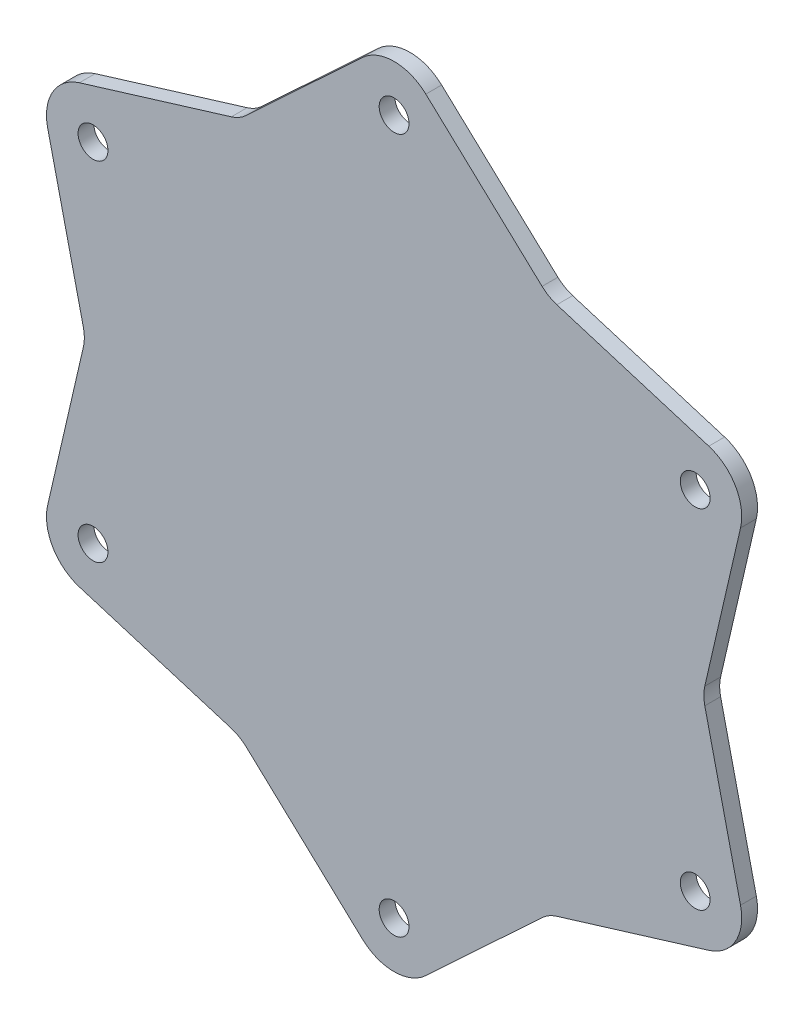
from build123d import *

# Parameters (mm, degrees)
SKETCH1_R           = 3
BOSS_EXTRUDE2_DEPTH = 3.175


with BuildPart() as part:
    # Sketch1 → Boss-Extrude2 (new body)
    with BuildSketch(Plane.XY):
        with BuildLine():
            Line((6.375679422, 76.689094378), (29.728991744, 54.9181954))
            ThreePointArc((29.728991744, 54.9181954), (31.115, 53.892760878), (32.696056474, 53.205159779))
            Line((32.696056474, 53.205159779), (63.226864214, 43.866047535))
            ThreePointArc((63.226864214, 43.866047535), (68.58921198, 39.6), (69.602543635, 32.823046843))
            Line((69.602543635, 32.823046843), (62.425048218, 1.713035621))
            ThreePointArc((62.425048218, 1.713035621), (62.23, 0), (62.425048218, -1.713035621))
            Line((62.425048218, -1.713035621), (69.602543635, -32.823046843))
            ThreePointArc((69.602543635, -32.823046843), (68.58921198, -39.6), (63.226864214, -43.866047535))
            Line((63.226864214, -43.866047535), (32.696056474, -53.205159779))
            ThreePointArc((32.696056474, -53.205159779), (31.115, -53.892760878), (29.728991744, -54.9181954))
            Line((29.728991744, -54.9181954), (6.375679422, -76.689094378))
            ThreePointArc((6.375679422, -76.689094378), (0, -79.2), (-6.375679422, -76.689094378))
            Line((-6.375679422, -76.689094378), (-29.728991744, -54.9181954))
            ThreePointArc((-29.728991744, -54.9181954), (-31.115, -53.892760878), (-32.696056474, -53.205159779))
            Line((-32.696056474, -53.205159779), (-63.226864214, -43.866047535))
            ThreePointArc((-63.226864214, -43.866047535), (-68.58921198, -39.6), (-69.602543635, -32.823046843))
            Line((-69.602543635, -32.823046843), (-62.425048218, -1.713035621))
            ThreePointArc((-62.425048218, -1.713035621), (-62.23, 0), (-62.425048218, 1.713035621))
            Line((-62.425048218, 1.713035621), (-69.602543635, 32.823046843))
            ThreePointArc((-69.602543635, 32.823046843), (-68.58921198, 39.6), (-63.226864214, 43.866047535))
            Line((-63.226864214, 43.866047535), (-32.696056474, 53.205159779))
            ThreePointArc((-32.696056474, 53.205159779), (-31.115, 53.892760878), (-29.728991744, 54.9181954))
            Line((-29.728991744, 54.9181954), (-6.375679422, 76.689094378))
            ThreePointArc((-6.375679422, 76.689094378), (0, 79.2), (6.375679422, 76.689094378))
        make_face()
        with Locations((0, 69.85)):
            Circle(SKETCH1_R, mode=Mode.SUBTRACT)
        with Locations((60.491874454, 34.925)):
            Circle(SKETCH1_R, mode=Mode.SUBTRACT)
        with Locations((60.491874454, -34.925)):
            Circle(SKETCH1_R, mode=Mode.SUBTRACT)
        with Locations((0, -69.85)):
            Circle(SKETCH1_R, mode=Mode.SUBTRACT)
        with Locations((-60.491874454, -34.925)):
            Circle(SKETCH1_R, mode=Mode.SUBTRACT)
        with Locations((-60.491874454, 34.925)):
            Circle(SKETCH1_R, mode=Mode.SUBTRACT)
    extrude(amount=BOSS_EXTRUDE2_DEPTH)


solid = part.part
